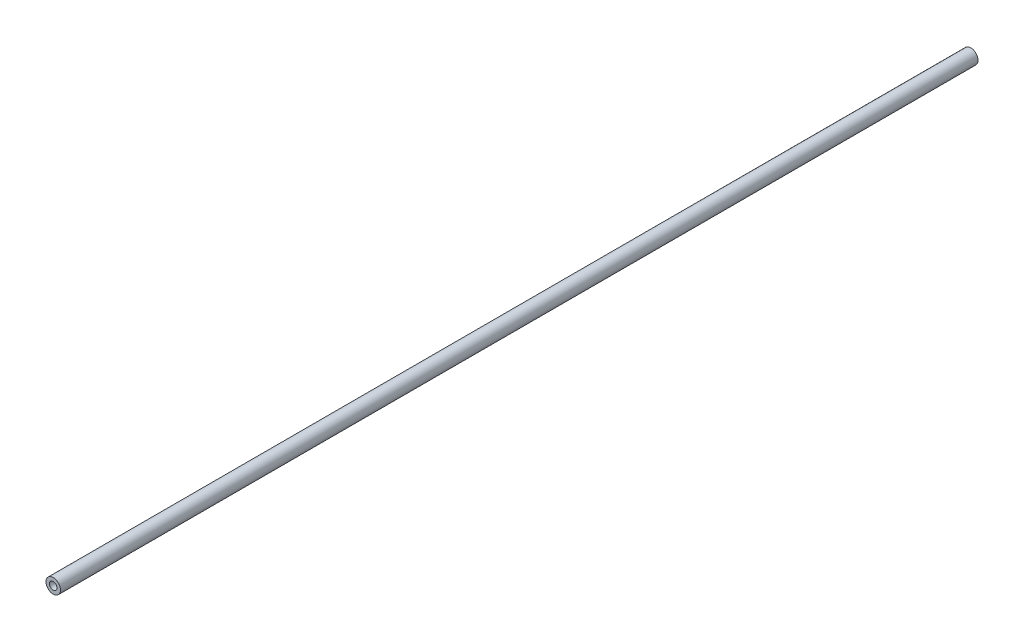
from build123d import *

# Parameters (mm, degrees)
SKETCH1_R           = 4.7625
SKETCH1_R_2         = 2.4892
BOSS_EXTRUDE1_DEPTH = 302.18126


with BuildPart() as part:
    # Sketch1 → Boss-Extrude1 (new, symmetric)
    with BuildSketch(Plane.XY):
        Circle(SKETCH1_R)
        Circle(SKETCH1_R_2, mode=Mode.SUBTRACT)
    extrude(amount=BOSS_EXTRUDE1_DEPTH, both=True)


solid = part.part
